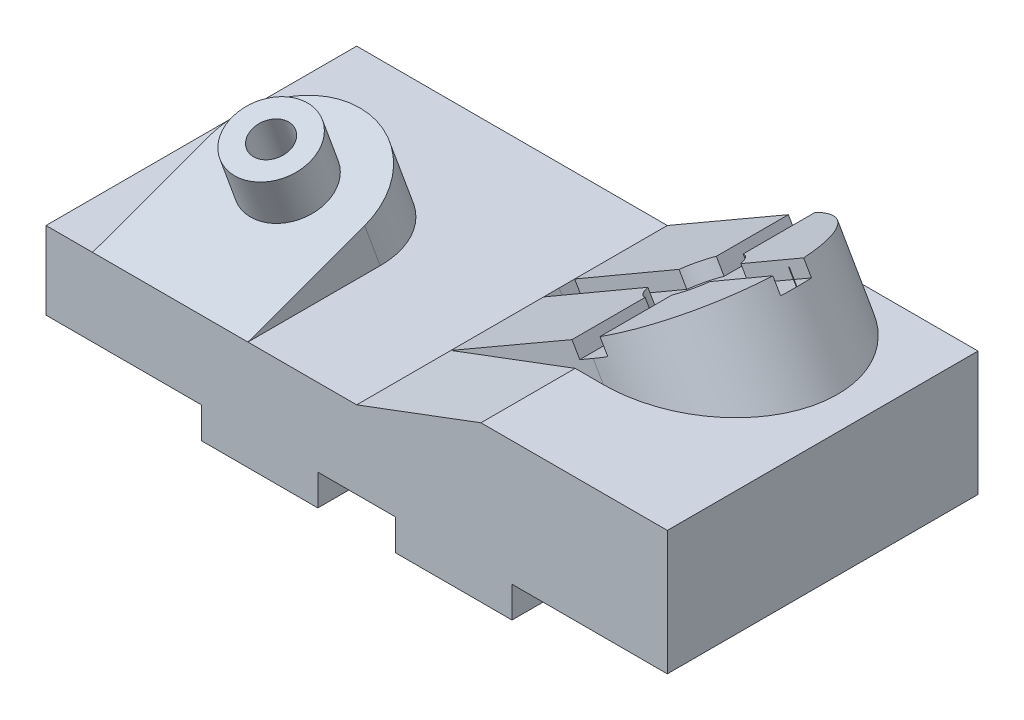
from build123d import *

# Parameters (mm, degrees)
BOSS_EXTRUDE1_DEPTH  = 100
BOSS_EXTRUDE2_REACH  = 207.357
SKETCH6_R            = 12.5
SKETCH6_R_2          = 6
BOSS_EXTRUDE4_DEPTH  = 15
SKETCH7_R            = 6
CUT_EXTRUDE3_DEPTH   = 206.356636358
BOSS_EXTRUDE10_REACH = 190.828
CUT_EXTRUDE6_DEPTH   = 5


with BuildPart() as part:
    # Sketch1 → Boss-Extrude1 (new body)
    with BuildSketch(Plane.XY):
        Polygon((-177.777777778, 0), (-177.777777778, 25), (-77.777777778, 25), (-37.777777778, 40), (22.222222222, 40), (22.222222222, 0), (-27.777777778, 0), (-27.777777778, -10), (-65.277777778, -10), (-65.277777778, 0), (-90.277777778, 0), (-90.277777778, -10), (-127.777777778, -10), (-127.777777778, 0), align=None)
    extrude(amount=BOSS_EXTRUDE1_DEPTH)

    # Sketch5 → Boss-Extrude2 (add, up to next)
    with BuildSketch(Plane(origin=(0, 54.214936023, 19.732622965), x_dir=(-1, 0, 0), z_dir=(0, 0.939692620785908, 0.34202014332566977)), mode=Mode.PRIVATE) as boss_extrude2_sk1:
        with BuildLine():
            Line((112.777777778, 85.418758495), (112.777777778, 45.418758495))
            ThreePointArc((112.777777778, 45.418758495), (137.777777778, 20.418758495), (162.777777778, 45.418758495))
            Line((162.777777778, 45.418758495), (162.777777778, 85.418758495))
            Line((162.777777778, 85.418758495), (112.777777778, 85.418758495))
        make_face()
    boss_extrude2_tool1 = extrude(boss_extrude2_sk1.sketch, amount=-BOSS_EXTRUDE2_REACH, mode=Mode.PRIVATE) - part.part
    add(boss_extrude2_tool1.solids().sort_by_distance((-137.777778, 35.287462, 71.735431))[0])

    # Sketch6 → Boss-Extrude4 (add)
    with BuildSketch(Plane(origin=(0, 54.214936023, 19.732622965), x_dir=(1, 0, 0), z_dir=(0, 0.9396926207859081, 0.3420201433256699))):
        with Locations(Location((-137.777777778, -45.418758495, 0), (0, 0, 270))):
            Circle(SKETCH6_R)
        with Locations(Location((-137.777777778, -45.418758495, 0), (0, 0, 270))):
            Circle(SKETCH6_R_2, mode=Mode.SUBTRACT)
    extrude(amount=BOSS_EXTRUDE4_DEPTH)

    # Sketch7 → Cut-Extrude3 (cut, through all)
    with BuildSketch(Plane(origin=(0, 54.214936023, 19.732622965), x_dir=(1, 0, 0), z_dir=(0, 0.9396926207859081, 0.3420201433256699))):
        with Locations(Location((-137.777777778, -45.418758495, 0), (0, 0, 270))):
            Circle(SKETCH7_R)
    extrude(amount=-CUT_EXTRUDE3_DEPTH, mode=Mode.SUBTRACT)

    # Sketch10 → Boss-Extrude10 (add, up to next)
    with BuildSketch(Plane(origin=(-30.269761992, 52.428765703, 0), x_dir=(0, 0, -1), z_dir=(-0.5000000000000012, 0.8660254037844379, 0)), mode=Mode.PRIVATE) as boss_extrude10_sk1:
        with BuildLine():
            Line((-69.661280828, 54.857531405), (-69.661280828, 4.857531405))
            ThreePointArc((-69.661280828, 4.857531405), (-37.095944154, -30.057686115), (0, 0))
            Line((0, 0), (0, 54.857531405))
            Line((0, 54.857531405), (-69.661280828, 54.857531405))
        make_face()
    boss_extrude10_tool1 = extrude(boss_extrude10_sk1.sketch, amount=-BOSS_EXTRUDE10_REACH, mode=Mode.PRIVATE) - part.part
    add(boss_extrude10_tool1.solids().sort_by_distance((-43.846947, 44.589974, 34.777462))[0])

    # Sketch11 → Cut-Extrude6 (cut)
    with BuildSketch(Plane(origin=(-30.269761992, 52.428765703, 0), x_dir=(0.866025403784438, 0.5000000000000012, 0), z_dir=(-0.5000000000000011, 0.8660254037844379, 0))):
        with BuildLine():
            Line((-54.857531405, -34.830640414), (-54.831038967, -39.830570229))
            Line((-54.831038967, -39.830570229), (-16.329059293, -39.626565102))
            ThreePointArc((-16.329059293, -39.626565102), (-13.709739092, -43.486722407), (-9.857531405, -46.117720065))
            Line((-9.857531405, -46.117720065), (-9.857531405, -69.661280828))
            Line((-9.857531405, -69.661280828), (-4.857531405, -69.661280828))
            ThreePointArc((-4.857531405, -69.661280828), (-2.351096218, -69.571419508), (0.142468595, -69.302296979))
            Line((0.142468595, -69.302296979), (0.142468595, -46.117720065))
            ThreePointArc((0.142468595, -46.117720065), (4.041313515, -43.439695211), (6.665968636, -39.50472452))
            Line((6.665968636, -39.50472452), (29.822643788, -39.382027441))
            ThreePointArc((29.822643788, -39.382027441), (30.065429756, -36.982225405), (30.142353187, -34.571400312))
            Line((30.142353187, -34.571400312), (30.141340464, -34.380268592))
            ThreePointArc((30.141340464, -34.380268592), (30.031317876, -31.874132501), (29.742071325, -29.382313987))
            Line((29.742071325, -29.382313987), (6.529563607, -29.505306898))
            ThreePointArc((6.529563607, -29.505306898), (3.92074784, -25.762302601), (0.142468595, -23.204841591))
            Line((0.142468595, -23.204841591), (0.142468595, -0.020264677))
            ThreePointArc((0.142468595, -0.020264677), (0.071244712, -0.010059118), (0, 0))
            Line((0, 0), (-9.857531405, 0))
            Line((-9.857531405, 0), (-9.857531405, -23.204841591))
            ThreePointArc((-9.857531405, -23.204841591), (-13.682838556, -25.808939121), (-16.298624018, -29.626263466))
            Line((-16.298624018, -29.626263466), (-54.857531405, -29.830570228))
            Line((-54.857531405, -29.830570228), (-54.857531405, -34.830640414))
        make_face()
    extrude(amount=-CUT_EXTRUDE6_DEPTH, mode=Mode.SUBTRACT)


solid = part.part
